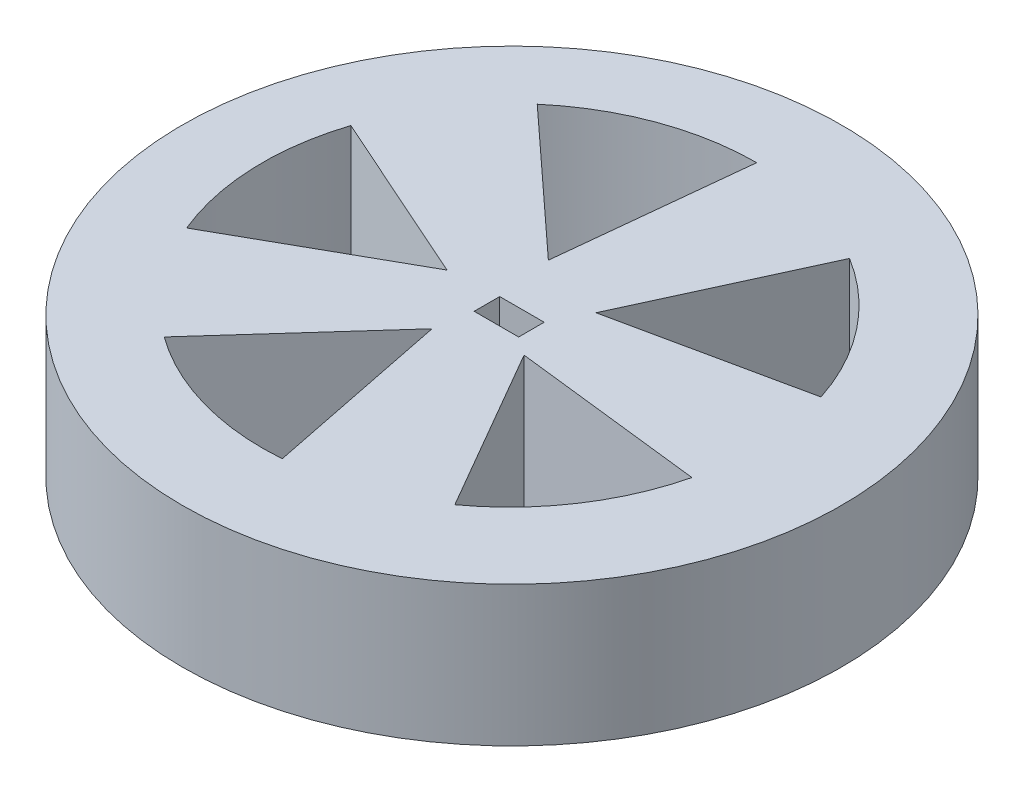
from build123d import *

# Parameters (mm, degrees)
ESQUISSE1_R             = 40
BOSS_EXTRU_1_DEPTH      = 17
ENL_V_MAT_EXTRU_1_DEPTH = 17
ESQUISSE7_W             = 5.4
ESQUISSE7_H             = 3.1
ENL_V_MAT_EXTRU_3_DEPTH = 20


with BuildPart() as part:
    # Esquisse1 → Boss.-Extru.1 (new body)
    with BuildSketch(Plane(origin=(0, 0, 0), x_dir=(1, 0, 0), z_dir=(0, 1, 0))):
        with Locations(Location((1.175962064, -0.881971548, 0), (0, 0, 270))):
            Circle(ESQUISSE1_R)
    extrude(amount=BOSS_EXTRU_1_DEPTH)

    # Esquisse4 → Enlèv. mat.-Extru.1 (cut)
    with BuildSketch(Plane(origin=(0, 17, 0), x_dir=(1, 0, 0), z_dir=(0, 1, 0))):
        with BuildLine():
            Line((-19.464562445, 22.82828966), (-2.391160411, 7.108611108))
            Line((-2.391160411, 7.108611108), (0, 30))
            ThreePointArc((0, 30), (-10.371868448, 28.150032769), (-19.464562445, 22.82828966))
        make_face()
        with BuildLine():
            ThreePointArc((28.531695489, 9.270509831), (23.567188485, 18.563071591), (15.696113054, 25.566228408))
            Line((15.696113054, 25.566228408), (6.021781713, 4.470810329))
            Line((6.021781713, 4.470810329), (28.531695489, 9.270509831))
        make_face()
        with BuildLine():
            ThreePointArc((17.633557569, -24.270509831), (24.937191951, -16.67742359), (29.165293804, -7.02749154))
            Line((29.165293804, -7.02749154), (6.112826182, -4.345498368))
            Line((6.112826182, -4.345498368), (17.633557569, -24.270509831))
        make_face()
        with BuildLine():
            Line((-2.243847365, -7.156476018), (-17.633557569, -24.270509831))
            ThreePointArc((-17.633557569, -24.270509831), (-8.155156276, -28.870286215), (2.329029809, -29.909457035))
            Line((2.329029809, -29.909457035), (-2.243847365, -7.156476018))
        make_face()
        with BuildLine():
            Line((-7.49960012, -0.077447051), (-28.531695489, 9.270509831))
            ThreePointArc((-28.531695489, 9.270509831), (-29.977355713, -1.165394555), (-27.725874221, -11.457569493))
            Line((-27.725874221, -11.457569493), (-7.49960012, -0.077447051))
        make_face()
    extrude(amount=-ENL_V_MAT_EXTRU_1_DEPTH, mode=Mode.SUBTRACT)

    # Esquisse7 → Enlèv. mat.-Extru.3 (cut)
    with BuildSketch(Plane(origin=(0, 0, 0), x_dir=(-1, 0, 0), z_dir=(0, -1, 0))):
        with Locations((-1.176467364, -1.217534794)):
            Rectangle(ESQUISSE7_W, ESQUISSE7_H)
    extrude(amount=-ENL_V_MAT_EXTRU_3_DEPTH, mode=Mode.SUBTRACT)


solid = part.part
